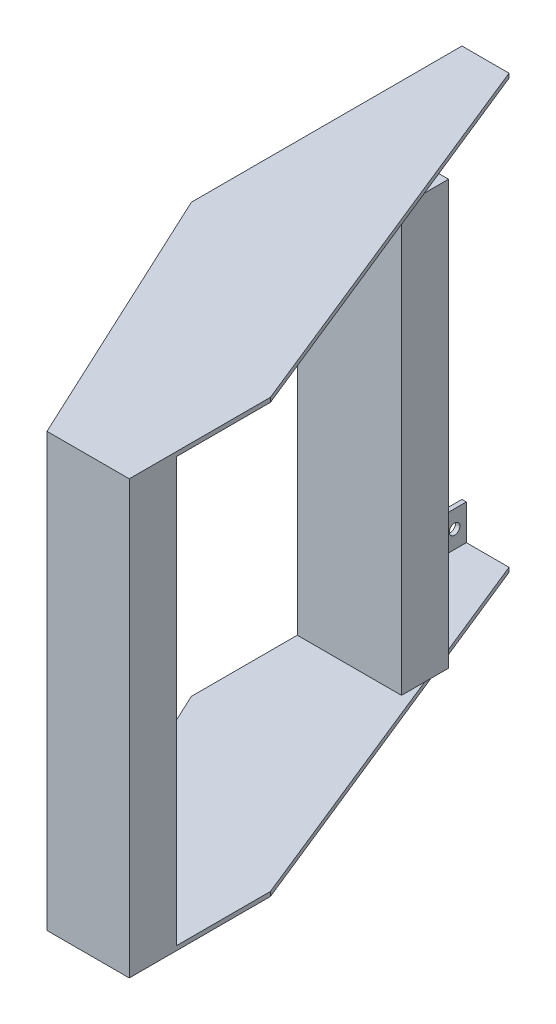
from build123d import *

# Parameters (mm, degrees)
BOSS_EXTRUDE1_DEPTH = 4.7498
SKETCH2_R           = 5.715
BOSS_EXTRUDE2_DEPTH = 4.7498
SKETCH3_W           = 112.522
SKETCH3_H           = 50.8
SKETCH3_W_2         = 88.835533053
BOSS_EXTRUDE3_DEPTH = 228.6


with BuildPart() as part:
    # Sketch1 → Boss-Extrude1 (new body)
    with BuildSketch(Plane(origin=(0, 0, 0), x_dir=(1, 0, 0), z_dir=(0, 1, 0))):
        Polygon((23.686466947, -292.1), (112.522, -292.1), (112.522, -139.7), (-61.722, 292.1), (-112.522, 292.1), (-112.522, 0), align=None)
    extrude(amount=BOSS_EXTRUDE1_DEPTH)



with BuildPart() as body_2:
    # Sketch2 → Boss-Extrude2 (new body)
    with BuildSketch(Plane(origin=(-112.522, 0, 11.737401462), x_dir=(0, 0, -1), z_dir=(1, 0, 0))):
        Polygon((176.837401462, 4.7498), (231.249840519, 42.8498), (303.837401462, 42.8498), (303.837401462, 4.7498), align=None)
        with Locations(Location((291.137401462, 23.7998, 0), (0, 0, 180))):
            Circle(SKETCH2_R, mode=Mode.SUBTRACT)
        with Locations(Location((240.337401462, 23.7998, 0), (0, 0, 180))):
            Circle(SKETCH2_R, mode=Mode.SUBTRACT)
    extrude(amount=BOSS_EXTRUDE2_DEPTH)


with BuildPart() as part_1:
    add(part.part)

    add(body_2.part)  # Boss-Extrude3 merges body 2
    # Sketch3 → Boss-Extrude3 (add)
    with BuildSketch(Plane(origin=(0, 4.7498, 0), x_dir=(1, 0, 0), z_dir=(0, 1, 0))):
        with Locations((-56.261, 139.7)):
            Rectangle(SKETCH3_W, SKETCH3_H)
        with Locations((68.104233474, -266.7)):
            Rectangle(SKETCH3_W_2, SKETCH3_H)
    extrude(amount=BOSS_EXTRUDE3_DEPTH)

    # Mirror1: part across plane


with BuildPart() as part_2:
    add(part_1.part)
    add(part_1.part.mirror(Plane.ZX.offset(233.3498)))


solid = part_2.part
